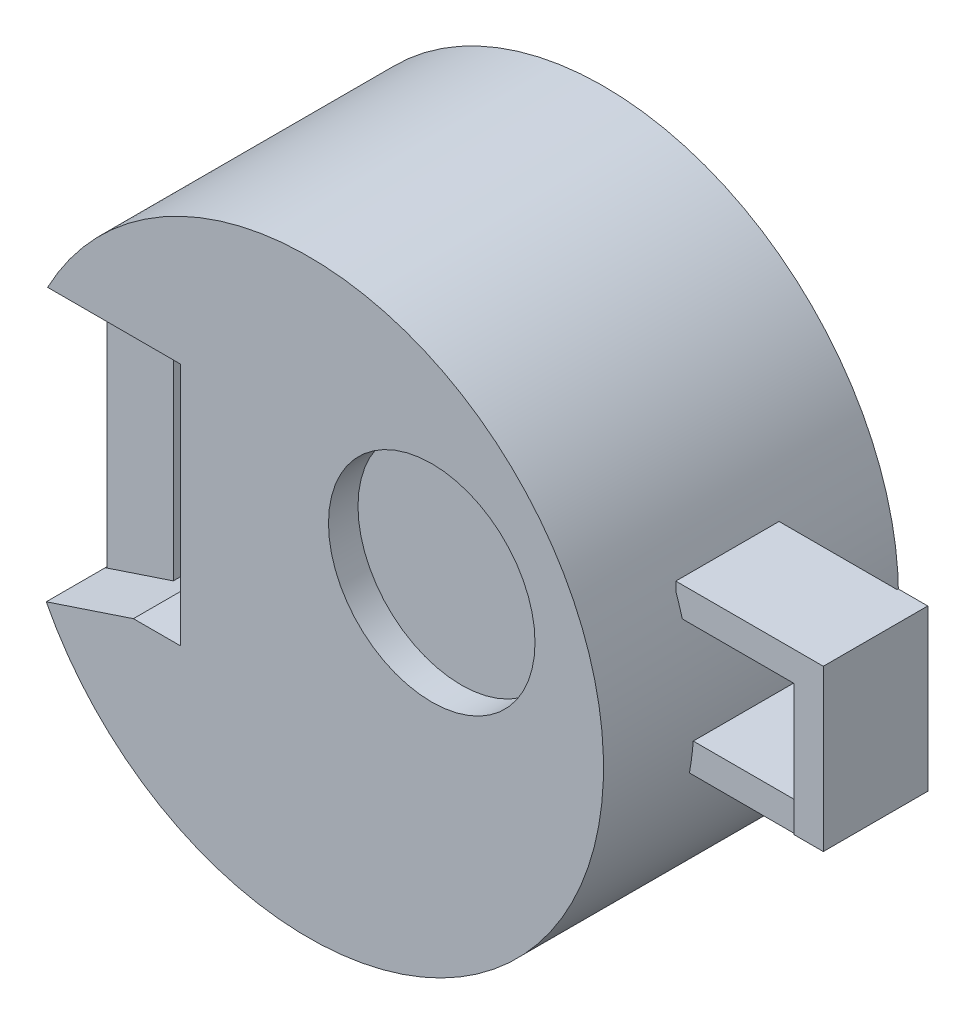
from build123d import *

# Parameters (mm, degrees)
SKETCH_1_R          = 10
EXTRUDE_1_DEPTH     = 10
SKETCH_2_W          = 1.600186535
SKETCH_2_H          = 8.27120278
CUT_EXTRUDE_1_DEPTH = 10
CUT_EXTRUDE_2_DEPTH = 2
CUT_EXTRUDE_3_DEPTH = 2
CUT_EXTRUDE_4_DEPTH = 3.5
CUT_EXTRUDE_5_DEPTH = 8
SKETCH_16_W         = 6
SKETCH_16_H         = 9.252604953
CUT_EXTRUDE_7_DEPTH = 1
SKETCH_17_R         = 3.5
CUT_EXTRUDE_8_DEPTH = 1
SKETCH_18_R         = 3.5
CUT_EXTRUDE_9_DEPTH = 1
SKETCH_19_W         = 3.5
SKETCH_19_H         = 1
EXTRUDE_2_DEPTH     = 4
SKETCH_20_W         = 3.5
SKETCH_20_H         = 1
EXTRUDE_3_DEPTH     = 4
SKETCH_21_W         = 3.540013918
SKETCH_21_H         = 5.43980515
EXTRUDE_4_DEPTH     = 1


with BuildPart() as part:
    # 草圖1 → 填料-伸長1 (new body)
    with BuildSketch(Plane.XY):
        Circle(SKETCH_1_R)
    extrude(amount=EXTRUDE_1_DEPTH)

    # 草圖2 → 除料-伸長1 (cut)
    with BuildSketch(Plane.XY.offset(10)):
        with Locations((-5.134616168, 0.535617876)):
            Rectangle(SKETCH_2_W, SKETCH_2_H)
    extrude(amount=-CUT_EXTRUDE_1_DEPTH, mode=Mode.SUBTRACT)

    # 草圖3 → 除料-伸長2 (cut)
    with BuildSketch(Plane.XY.offset(10)):
        with BuildLine():
            Line((-5.934709435, 4.671219266), (-8.84192912, 4.671219266))
            ThreePointArc((-8.84192912, 4.671219266), (-10.338729016, 0.052381637), (-8.888807861, -4.581385687))
            Line((-8.888807861, -4.581385687), (-5.934709435, -3.599983514))
            Line((-5.934709435, -3.599983514), (-5.934709435, 4.671219266))
        make_face()
    extrude(amount=-CUT_EXTRUDE_2_DEPTH, mode=Mode.SUBTRACT)

    # 草圖4 → 除料-伸長3 (cut)
    with BuildSketch(Plane(origin=(0, 0, 0), x_dir=(-1, 0, 0), z_dir=(0, 0, -1))):
        with BuildLine():
            Line((5.934709435, 4.671219266), (8.84192912, 4.671219266))
            ThreePointArc((8.84192912, 4.671219266), (10.34374886, 0.021931836), (8.86165829, -4.633682375))
            Line((8.86165829, -4.633682375), (5.934709435, -4.633682375))
            Line((5.934709435, -4.633682375), (5.934709435, 4.671219266))
        make_face()
    extrude(amount=-CUT_EXTRUDE_3_DEPTH, mode=Mode.SUBTRACT)

    # 草圖7 → 除料-伸長4 (cut)
    with BuildSketch(Plane.ZY.offset(13.3345229)):
        Polygon((2, 4.671219266), (8, 4.671219266), (8, -4.581385687), (2, -4.633682375), align=None)
    extrude(amount=-CUT_EXTRUDE_4_DEPTH, mode=Mode.SUBTRACT)

    # 草圖9 → 除料-伸長5 (cut)
    with BuildSketch(Plane.XY.offset(8)):
        Polygon((-5.934709435, 4.614635236), (-5.934709435, -3.599983514), (-6.581816343, -3.814963529), (-6.581816343, 4.614635236), align=None)
    extrude(amount=-CUT_EXTRUDE_5_DEPTH, mode=Mode.SUBTRACT)

    # 草圖16 → 除料-伸長7 (cut)
    with BuildSketch(Plane.ZY.offset(9.8345229)):
        with Locations((5, 0.04491679)):
            Rectangle(SKETCH_16_W, SKETCH_16_H)
    extrude(amount=-CUT_EXTRUDE_7_DEPTH, mode=Mode.SUBTRACT)

    # 草圖17 → 除料-伸長8 (cut)
    with BuildSketch(Plane(origin=(0, 0, 0), x_dir=(-1, 0, 0), z_dir=(0, 0, -1))):
        with Locations((-3.576623966, 1.840103877)):
            Circle(SKETCH_17_R)
    extrude(amount=-CUT_EXTRUDE_8_DEPTH, mode=Mode.SUBTRACT)

    # 草圖18 → 除料-伸長9 (cut)
    with BuildSketch(Plane.XY.offset(10)):
        with Locations((4.177553206, 2.507636002)):
            Circle(SKETCH_18_R)
    extrude(amount=-CUT_EXTRUDE_9_DEPTH, mode=Mode.SUBTRACT)

    # 草圖19 → 填料-伸長2 (add)
    with BuildSketch(Plane(origin=(9.418183657, 0, 0), x_dir=(0, 0, -1), z_dir=(1, 0, 0))):
        with Locations((-5.219032707, 3.16388309)):
            Rectangle(SKETCH_19_W, SKETCH_19_H)
    extrude(amount=EXTRUDE_2_DEPTH)

    # 草圖20 → 填料-伸長3 (add)
    with BuildSketch(Plane(origin=(9.418183657, 0, 0), x_dir=(0, 0, -1), z_dir=(1, 0, 0))):
        with Locations((-5.179018789, -1.27592206)):
            Rectangle(SKETCH_20_W, SKETCH_20_H)
    extrude(amount=EXTRUDE_3_DEPTH)

    # 草圖21 → 填料-伸長4 (add)
    with BuildSketch(Plane(origin=(13.418183657, 0, 0), x_dir=(0, 0, -1), z_dir=(1, 0, 0))):
        with Locations((-5.199025748, 0.943980515)):
            Rectangle(SKETCH_21_W, SKETCH_21_H)
    extrude(amount=EXTRUDE_4_DEPTH)


solid = part.part
